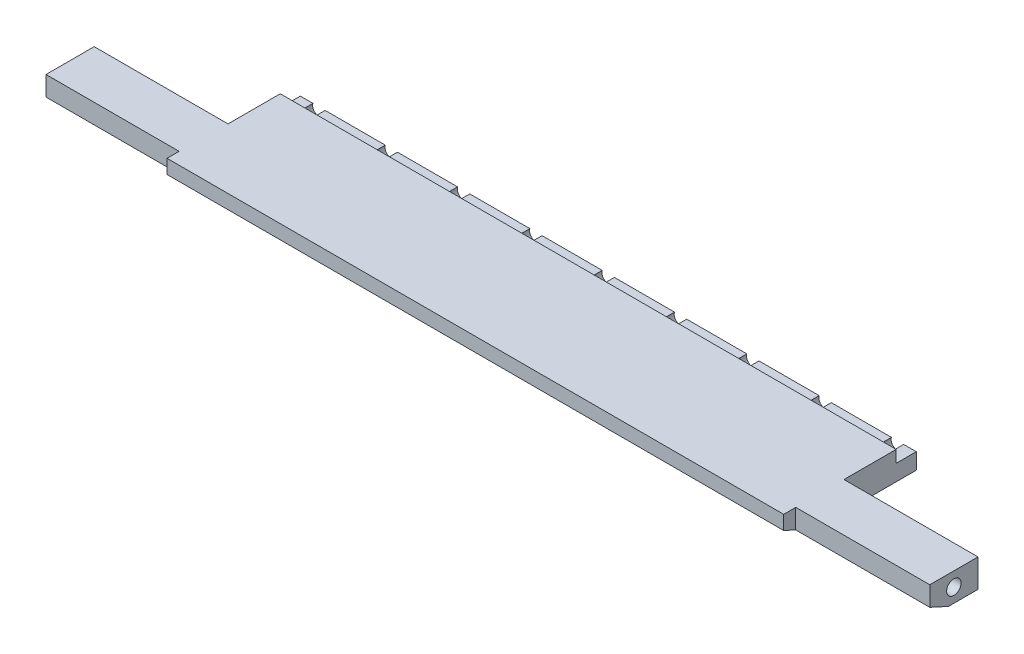
from build123d import *

# Parameters (mm, degrees)
SKETCH_1_W          = 220
SKETCH_1_H          = 7
SKETCH_1_R          = 1.6
EXTRUDE_1_DEPTH     = 30
SKETCH_2_W          = 220
SKETCH_2_H          = 5
CUT_EXTRUDE_1_DEPTH = 3
SKETCH_3_W          = 33.308675227
SKETCH_3_H          = 18
SKETCH_3_W_2        = 33.368675227
CUT_EXTRUDE_2_DEPTH = 223.146348158
SKETCH_6_W          = 153.495185447
SKETCH_6_H          = 7
EXTRUDE_2_DEPTH     = 3
SKETCH_7_R          = 1.8
CUT_EXTRUDE_3_DEPTH = 10
CUT_EXTRUDE_START   = -10
SKETCH_8_R          = 1.8
CUT_EXTRUDE_4_DEPTH = 10
CUT_EXTRUDE_5_DEPTH = 223.571336879


with BuildPart() as part:
    # Эскиз1 → Бобышка-Вытянуть1 (new body)
    with BuildSketch(Plane.XY):
        with Locations((110, 3.5)):
            Rectangle(SKETCH_1_W, SKETCH_1_H)
        with Locations((37.97, 3.5)):
            Circle(SKETCH_1_R, mode=Mode.SUBTRACT)
        with Locations((55.97, 3.5)):
            Circle(SKETCH_1_R, mode=Mode.SUBTRACT)
        with Locations((73.97, 3.5)):
            Circle(SKETCH_1_R, mode=Mode.SUBTRACT)
        with Locations((91.97, 3.5)):
            Circle(SKETCH_1_R, mode=Mode.SUBTRACT)
        with Locations((109.97, 3.5)):
            Circle(SKETCH_1_R, mode=Mode.SUBTRACT)
        with Locations((127.97, 3.5)):
            Circle(SKETCH_1_R, mode=Mode.SUBTRACT)
        with Locations((145.97, 3.5)):
            Circle(SKETCH_1_R, mode=Mode.SUBTRACT)
        with Locations((163.97, 3.5)):
            Circle(SKETCH_1_R, mode=Mode.SUBTRACT)
        with Locations((181.97, 3.5)):
            Circle(SKETCH_1_R, mode=Mode.SUBTRACT)
    extrude(amount=EXTRUDE_1_DEPTH)

    # Эскиз2 → Вырез-Вытянуть1 (cut)
    with BuildSketch(Plane(origin=(0, 7, 0), x_dir=(1, 0, 0), z_dir=(0, 1, 0))):
        with Locations((110, -2.5)):
            Rectangle(SKETCH_2_W, SKETCH_2_H)
    extrude(amount=-CUT_EXTRUDE_1_DEPTH, mode=Mode.SUBTRACT)

    # Эскиз3 → Вырез-Вытянуть2 (cut, through all)
    with BuildSketch(Plane(origin=(0, 7, 0), x_dir=(1, 0, 0), z_dir=(0, 1, 0))):
        with Locations((16.654337614, -9)):
            Rectangle(SKETCH_3_W, SKETCH_3_H)
        with Locations((203.315662387, -9)):
            Rectangle(SKETCH_3_W_2, SKETCH_3_H)
    extrude(amount=-CUT_EXTRUDE_2_DEPTH, mode=Mode.SUBTRACT)

    # Эскиз6 → Бобышка-Вытянуть2 (add)
    with BuildSketch(Plane.XY.offset(30)):
        with Locations((109.88373205, 3.5)):
            Rectangle(SKETCH_6_W, SKETCH_6_H)
    extrude(amount=EXTRUDE_2_DEPTH)

    # Эскиз7 → Вырез-Вытянуть3 (cut)
    with BuildSketch(Plane.ZY):
        with Locations((24, 3.5)):
            Circle(SKETCH_7_R)
    extrude(amount=-CUT_EXTRUDE_3_DEPTH, mode=Mode.SUBTRACT)

    # Эскиз8 → Вырез-Вытянуть4 (cut)
    with BuildSketch(Plane(origin=(220, 0, 0), x_dir=(0, 0, -1), z_dir=(1, 0, 0)).offset(CUT_EXTRUDE_START)):
        with Locations(Location((-24, 3.5, 0), (0, 0, 180))):
            Circle(SKETCH_8_R)
    extrude(amount=CUT_EXTRUDE_4_DEPTH, mode=Mode.SUBTRACT)

    # Эскиз9 → Вырез-Вытянуть5 (cut, through all)
    with BuildSketch(Plane(origin=(220, 0, 0), x_dir=(0, 0, -1), z_dir=(1, 0, 0))):
        Polygon((-33, 0), (-33, 3.5), (-25.349385808, 0), align=None)
    extrude(amount=-CUT_EXTRUDE_5_DEPTH, mode=Mode.SUBTRACT)


solid = part.part
